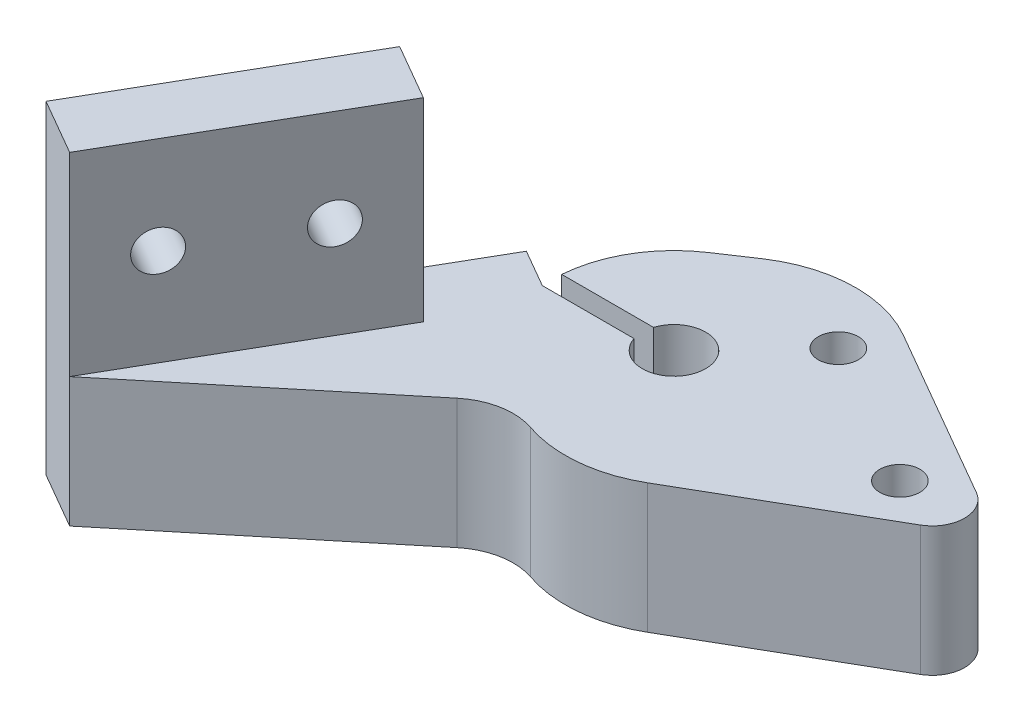
from build123d import *

# Parameters (mm, degrees)
SKETCH1_R                       = 1.55
SKETCH1_R_2                     = 2.45
BOSS_EXTRUDE1_DEPTH             = 10
SKETCH2_W                       = 9.45
SKETCH2_H                       = 1.5
CUT_EXTRUDE1_DEPTH              = 25.542893997
BOSS_EXTRUDE3_DEPTH             = 10
BOSS_EXTRUDE4_DEPTH             = 15
F_3_0MM_CLEARANCE_DOWEL_HOLE1_D = 3.108
FILLET1_R                       = 5


with BuildPart() as part:
    # Sketch1 → Boss-Extrude1 (new body)
    with BuildSketch(Plane(origin=(0, 0, 0), x_dir=(1, 0, 0), z_dir=(0, 1, 0))):
        with BuildLine():
            Line((11.25, 2.165063509), (-2.121223771, 9.884943153))
            ThreePointArc((-2.121223771, 9.884943153), (-7.442989886, 11.219511103), (-12.667897108, 9.545411133))
            Line((-12.667897108, 9.545411133), (-15.191606303, 7.863082307))
            ThreePointArc((-15.191606303, 7.863082307), (-19.4, 0), (-15.191606303, -7.863082307))
            Line((-15.191606303, -7.863082307), (-12.667897108, -9.545411133))
            ThreePointArc((-12.667897108, -9.545411133), (-7.442989886, -11.219511103), (-2.121223771, -9.884943153))
            Line((-2.121223771, -9.884943153), (11.25, -2.165063509))
            ThreePointArc((11.25, -2.165063509), (12.5, 0), (11.25, 2.165063509))
        make_face()
        with Locations(Location((7.5, 0, 0), (0, 0, 270))):
            Circle(SKETCH1_R, mode=Mode.SUBTRACT)
        with Locations(Location((-3.75, 6.495190528, 0), (0, 0, 270))):
            Circle(SKETCH1_R, mode=Mode.SUBTRACT)
        with Locations(Location((-9.95, 0, 0), (0, 0, 270))):
            Circle(SKETCH1_R_2, mode=Mode.SUBTRACT)
    extrude(amount=BOSS_EXTRUDE1_DEPTH)

    # Sketch2 → Cut-Extrude1 (cut, through all)
    with BuildSketch(Plane(origin=(0, 10, 0), x_dir=(1, 0, 0), z_dir=(0, 1, 0))):
        with Locations((-14.675, 0)):
            Rectangle(SKETCH2_W, SKETCH2_H)
    extrude(amount=-CUT_EXTRUDE1_DEPTH, mode=Mode.SUBTRACT)

    # Sketch3 → Boss-Extrude3 (add)
    with BuildSketch(Plane.XZ):
        with BuildLine():
            Line((-35.868683143, 22.59247598), (-22.285990587, -0.93343763))
            Line((-22.285990587, -0.93343763), (-19.370191081, 0.75))
            ThreePointArc((-19.370191081, 0.75), (-18.098070975, 4.786589536), (-15.191606303, 7.863082307))
            Line((-15.191606303, 7.863082307), (-12.667897108, 9.545411133))
            Line((-12.667897108, 9.545411133), (-31.538556124, 25.09247598))
            Line((-31.538556124, 25.09247598), (-35.868683143, 22.59247598))
        make_face()
    extrude(amount=-BOSS_EXTRUDE3_DEPTH)

    # Sketch4 → Boss-Extrude4 (add)
    with BuildSketch(Plane(origin=(0, 10, 0), x_dir=(1, 0, 0), z_dir=(0, 1, 0))):
        Polygon((-35.868683143, -22.59247598), (-25.868683143, -5.271967904), (-21.538556124, -7.771967904), (-31.538556124, -25.09247598), align=None)
    extrude(amount=BOSS_EXTRUDE4_DEPTH)

    # Ø3.0mm Clearance Dowel Hole1 (through all)
    with Locations(Plane(origin=(-12.788556272, 0, -7.383476406), x_dir=(0.5000000000000013, 0, -0.8660254037844379), z_dir=(0.8660254037844379, 0, 0.5000000000000013))):
        with Locations((-32.499999704, 17.5), (-22.499999704, 17.5)):
            Hole(F_3_0MM_CLEARANCE_DOWEL_HOLE1_D / 2)

    # Fillet1
    fillet1_edges = [part.edges().sort_by_distance(p)[0] for p in [
        (-12.667897108, 5, 9.545411133),
    ]]
    fillet(fillet1_edges, radius=FILLET1_R)


solid = part.part
